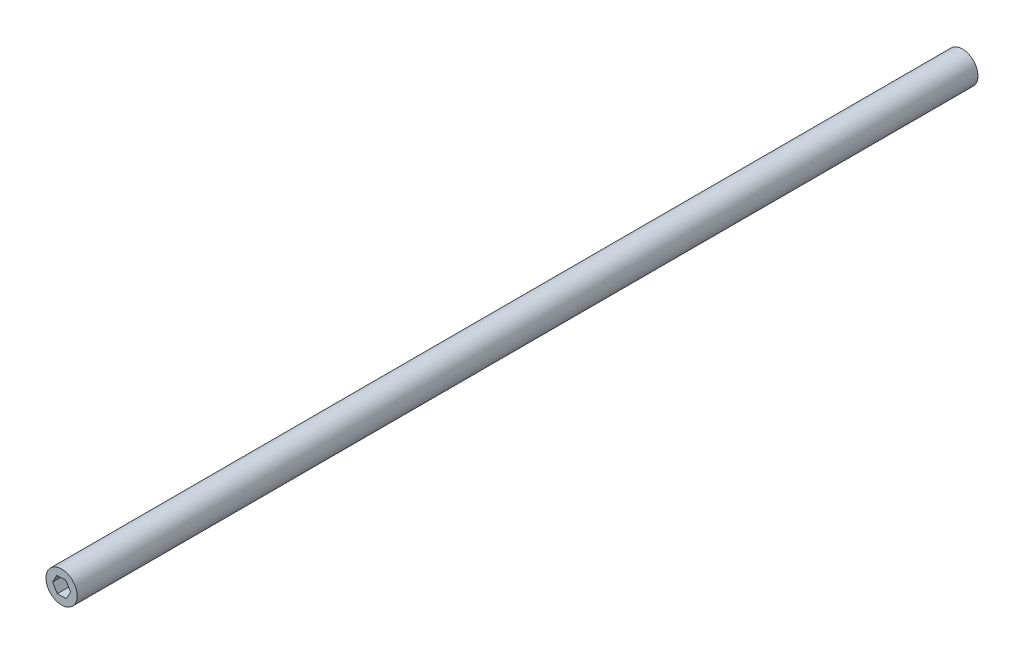
from build123d import *

# Parameters (mm, degrees)
SKETCH1_R           = 12.7
BOSS_EXTRUDE1_DEPTH = 732.282


with BuildPart() as part:
    # Sketch1 → Boss-Extrude1 (new body)
    with BuildSketch(Plane.XY):
        Circle(SKETCH1_R)
        Polygon((3.829083234, -6.253115617), (7.329898594, 0.189525546), (3.50081536, 6.442641162), (-3.829083234, 6.253115617), (-7.329898594, -0.189525546), (-3.50081536, -6.442641162), align=None, mode=Mode.SUBTRACT)
    extrude(amount=BOSS_EXTRUDE1_DEPTH)


solid = part.part
